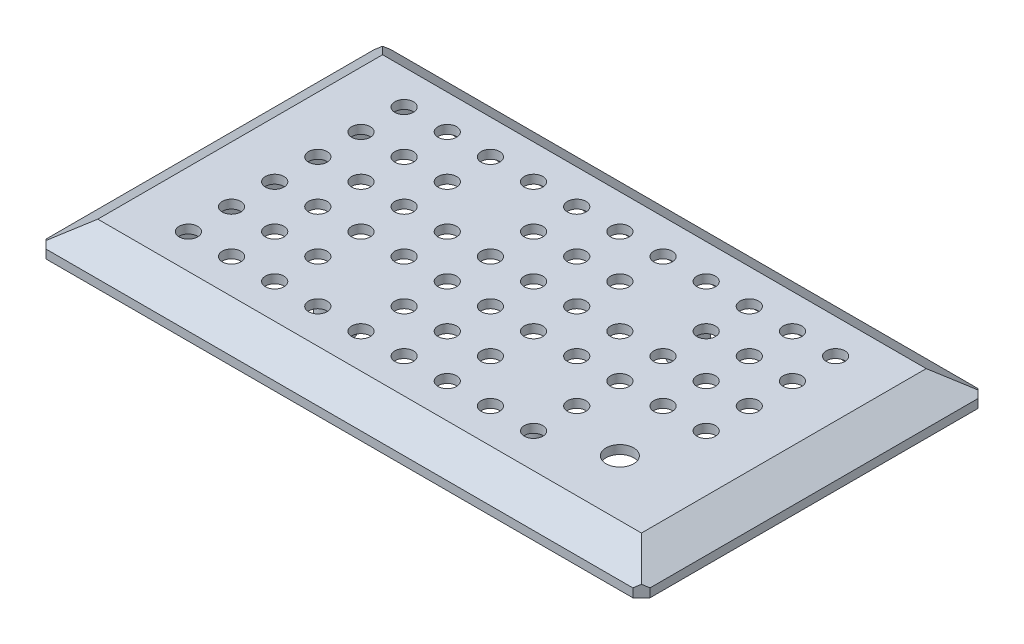
from build123d import *

# Parameters (mm, degrees)
SKETCH1_W                       = 140
SKETCH1_H                       = 80
BOSS_EXTRUDE1_DEPTH             = 2
CHAMFER2_SIZE                   = 2
SKETCH4_W                       = 8
SKETCH4_H                       = 10
BOSS_EXTRUDE2_DEPTH             = 7
SKETCH5_R                       = 2.05
CUT_EXTRUDE1_DEPTH              = 139.965499445
SKETCH6_W                       = 107.8
SKETCH6_H                       = 64
CUT_EXTRUDE2_DEPTH              = 5
SKIZZE1_R                       = 2.15
SCHNITT_LINEAR_AUSTRAGEN2_DEPTH = 10
SKIZZE2_W                       = 14.3
SKIZZE2_H                       = 14.3
SKIZZE2_R                       = 3.2
AUFSATZ_LINEAR_AUSTRAGEN1_DEPTH = 2
SKIZZE2_4_R                     = 3.2
SCHNITT_LINEAR_AUSTRAGEN4_DEPTH = 10
SKIZZE5_R                       = 2.15
AUFSATZ_LINEAR_AUSTRAGEN2_DEPTH = 2
SKIZZE4_R                       = 3.65
SKIZZE4_R_2                     = 2.05
AUFSATZ_LINEAR_AUSTRAGEN3_DEPTH = 10


with BuildPart() as part:
    # Sketch1 → Boss-Extrude1 (new body)
    with BuildSketch(Plane(origin=(0, 0, 0), x_dir=(1, 0, 0), z_dir=(0, 1, 0))):
        Rectangle(SKETCH1_W, SKETCH1_H)
    extrude(amount=BOSS_EXTRUDE1_DEPTH)

    # Sketch3 → Loft1 section 0
    with BuildSketch(Plane(origin=(0, 7, 0), x_dir=(1, 0, 0), z_dir=(0, 1, 0))):
        with BuildLine():
            Line((-63, -33), (63, -33))
            Line((63, -33), (63, 33))
            Line((63, 33), (-63, 33))
            Line((-63, 33), (-63, -33))
        make_face()
    # Sketch2 → Loft1 section 1
    with BuildSketch(Plane(origin=(0, 2, 0), x_dir=(1, 0, 0), z_dir=(0, 1, 0))):
        with BuildLine():
            Line((70, -40), (70, 40))
            Line((70, 40), (-70, 40))
            Line((-70, 40), (-70, -40))
            Line((-70, -40), (70, -40))
        make_face()
    loft()

    # Chamfer2
    chamfer2_edges = [part.edges().sort_by_distance(p)[0] for p in [
        (70, 1, 40),
        (-70, 1, 40),
        (-70, 1, -40),
        (70, 1, -40),
    ]]
    chamfer(chamfer2_edges, length=CHAMFER2_SIZE)

    # Sketch4 → Boss-Extrude2 (add)
    with BuildSketch(Plane.XZ):
        with Locations((-58.9, 20)):
            Rectangle(SKETCH4_W, SKETCH4_H)
        with Locations((-58.9, -20)):
            Rectangle(SKETCH4_W, SKETCH4_H)
        with Locations((58.9, -20)):
            Rectangle(SKETCH4_W, SKETCH4_H)
        with Locations((58.9, 20)):
            Rectangle(SKETCH4_W, SKETCH4_H)
    extrude(amount=BOSS_EXTRUDE2_DEPTH)

    # Sketch5 → Cut-Extrude1 (cut, through all)
    with BuildSketch(Plane.ZY.offset(62.9)):
        with Locations((-20, -3.5)):
            Circle(SKETCH5_R)
        with Locations((20, -3.5)):
            Circle(SKETCH5_R)
    extrude(amount=-CUT_EXTRUDE1_DEPTH, mode=Mode.SUBTRACT)

    # Sketch6 → Cut-Extrude2 (cut)
    with BuildSketch(Plane.XZ):
        Rectangle(SKETCH6_W, SKETCH6_H)
    extrude(amount=-CUT_EXTRUDE2_DEPTH, mode=Mode.SUBTRACT)

    # Skizze1 → Schnitt-Linear austragen2 (cut)
    with BuildSketch(Plane(origin=(0, 7, 0), x_dir=(1, 0, 0), z_dir=(0, 1, 0))):
        with Locations(Location((-50, -25, 0), (0, 0, 270))):
            Circle(SKIZZE1_R)
        with Locations(Location((-40, -25, 0), (0, 0, 270))):
            Circle(SKIZZE1_R)
        with Locations(Location((-30, -25, 0), (0, 0, 270))):
            Circle(SKIZZE1_R)
        with Locations(Location((-20, -25, 0), (0, 0, 270))):
            Circle(SKIZZE1_R)
        with Locations(Location((-10, -25, 0), (0, 0, 270))):
            Circle(SKIZZE1_R)
        with Locations(Location((0, -25, 0), (0, 0, 270))):
            Circle(SKIZZE1_R)
        with Locations(Location((10, -25, 0), (0, 0, 270))):
            Circle(SKIZZE1_R)
        with Locations(Location((20, -25, 0), (0, 0, 270))):
            Circle(SKIZZE1_R)
        with Locations(Location((30, -25, 0), (0, 0, 270))):
            Circle(SKIZZE1_R)
        with Locations(Location((40, -25, 0), (0, 0, 270))):
            Circle(SKIZZE1_R)
        with Locations(Location((50, -25, 0), (0, 0, 270))):
            Circle(SKIZZE1_R)
        with Locations(Location((-40, -15, 0), (0, 0, 270))):
            Circle(SKIZZE1_R)
        with Locations(Location((-30, -15, 0), (0, 0, 270))):
            Circle(SKIZZE1_R)
        with Locations(Location((-20, -15, 0), (0, 0, 270))):
            Circle(SKIZZE1_R)
        with Locations(Location((-10, -15, 0), (0, 0, 270))):
            Circle(SKIZZE1_R)
        with Locations(Location((0, -15, 0), (0, 0, 270))):
            Circle(SKIZZE1_R)
        with Locations(Location((10, -15, 0), (0, 0, 270))):
            Circle(SKIZZE1_R)
        with Locations(Location((20, -15, 0), (0, 0, 270))):
            Circle(SKIZZE1_R)
        with Locations(Location((30, -15, 0), (0, 0, 270))):
            Circle(SKIZZE1_R)
        with Locations(Location((40, -15, 0), (0, 0, 270))):
            Circle(SKIZZE1_R)
        with Locations(Location((50, -15, 0), (0, 0, 270))):
            Circle(SKIZZE1_R)
        with Locations(Location((-40, -5, 0), (0, 0, 270))):
            Circle(SKIZZE1_R)
        with Locations(Location((-30, -5, 0), (0, 0, 270))):
            Circle(SKIZZE1_R)
        with Locations(Location((-20, -5, 0), (0, 0, 270))):
            Circle(SKIZZE1_R)
        with Locations(Location((-10, -5, 0), (0, 0, 270))):
            Circle(SKIZZE1_R)
        with Locations(Location((0, -5, 0), (0, 0, 270))):
            Circle(SKIZZE1_R)
        with Locations(Location((10, -5, 0), (0, 0, 270))):
            Circle(SKIZZE1_R)
        with Locations(Location((20, -5, 0), (0, 0, 270))):
            Circle(SKIZZE1_R)
        with Locations(Location((30, -5, 0), (0, 0, 270))):
            Circle(SKIZZE1_R)
        with Locations(Location((40, -5, 0), (0, 0, 270))):
            Circle(SKIZZE1_R)
        with Locations(Location((50, -5, 0), (0, 0, 270))):
            Circle(SKIZZE1_R)
        with Locations(Location((-40, 5, 0), (0, 0, 270))):
            Circle(SKIZZE1_R)
        with Locations(Location((-30, 5, 0), (0, 0, 270))):
            Circle(SKIZZE1_R)
        with Locations(Location((-20, 5, 0), (0, 0, 270))):
            Circle(SKIZZE1_R)
        with Locations(Location((-10, 5, 0), (0, 0, 270))):
            Circle(SKIZZE1_R)
        with Locations(Location((0, 5, 0), (0, 0, 270))):
            Circle(SKIZZE1_R)
        with Locations(Location((10, 5, 0), (0, 0, 270))):
            Circle(SKIZZE1_R)
        with Locations(Location((20, 5, 0), (0, 0, 270))):
            Circle(SKIZZE1_R)
        with Locations(Location((30, 5, 0), (0, 0, 270))):
            Circle(SKIZZE1_R)
        with Locations(Location((40, 5, 0), (0, 0, 270))):
            Circle(SKIZZE1_R)
        with Locations(Location((50, 5, 0), (0, 0, 270))):
            Circle(SKIZZE1_R)
        with Locations(Location((-40, 15, 0), (0, 0, 270))):
            Circle(SKIZZE1_R)
        with Locations(Location((-30, 15, 0), (0, 0, 270))):
            Circle(SKIZZE1_R)
        with Locations(Location((-20, 15, 0), (0, 0, 270))):
            Circle(SKIZZE1_R)
        with Locations(Location((-10, 15, 0), (0, 0, 270))):
            Circle(SKIZZE1_R)
        with Locations(Location((0, 15, 0), (0, 0, 270))):
            Circle(SKIZZE1_R)
        with Locations(Location((10, 15, 0), (0, 0, 270))):
            Circle(SKIZZE1_R)
        with Locations(Location((20, 15, 0), (0, 0, 270))):
            Circle(SKIZZE1_R)
        with Locations(Location((30, 15, 0), (0, 0, 270))):
            Circle(SKIZZE1_R)
        with Locations(Location((40, 15, 0), (0, 0, 270))):
            Circle(SKIZZE1_R)
        with Locations(Location((50, 15, 0), (0, 0, 270))):
            Circle(SKIZZE1_R)
        with Locations(Location((-40, 25, 0), (0, 0, 270))):
            Circle(SKIZZE1_R)
        with Locations(Location((-30, 25, 0), (0, 0, 270))):
            Circle(SKIZZE1_R)
        with Locations(Location((-20, 25, 0), (0, 0, 270))):
            Circle(SKIZZE1_R)
        with Locations(Location((-10, 25, 0), (0, 0, 270))):
            Circle(SKIZZE1_R)
        with Locations(Location((0, 25, 0), (0, 0, 270))):
            Circle(SKIZZE1_R)
        with Locations(Location((10, 25, 0), (0, 0, 270))):
            Circle(SKIZZE1_R)
        with Locations(Location((20, 25, 0), (0, 0, 270))):
            Circle(SKIZZE1_R)
        with Locations(Location((30, 25, 0), (0, 0, 270))):
            Circle(SKIZZE1_R)
        with Locations(Location((40, 25, 0), (0, 0, 270))):
            Circle(SKIZZE1_R)
        with Locations(Location((50, 25, 0), (0, 0, 270))):
            Circle(SKIZZE1_R)
        with Locations(Location((-50, -15, 0), (0, 0, 270))):
            Circle(SKIZZE1_R)
        with Locations(Location((-50, -5, 0), (0, 0, 270))):
            Circle(SKIZZE1_R)
        with Locations(Location((-50, 5, 0), (0, 0, 270))):
            Circle(SKIZZE1_R)
        with Locations(Location((-50, 15, 0), (0, 0, 270))):
            Circle(SKIZZE1_R)
        with Locations(Location((-50, 25, 0), (0, 0, 270))):
            Circle(SKIZZE1_R)
    extrude(amount=-SCHNITT_LINEAR_AUSTRAGEN2_DEPTH, mode=Mode.SUBTRACT)

    # Skizze2 → Aufsatz-Linear austragen1 (add)
    with BuildSketch(Plane(origin=(0, 7, 0), x_dir=(1, 0, 0), z_dir=(0, 1, 0))):
        with Locations((45, -20)):
            Rectangle(SKIZZE2_W, SKIZZE2_H)
        with Locations((45, -20)):
            Circle(SKIZZE2_R, mode=Mode.SUBTRACT)
    extrude(amount=-AUFSATZ_LINEAR_AUSTRAGEN1_DEPTH)

    # Skizze2<4> → Schnitt-Linear austragen4 (cut)
    with BuildSketch(Plane(origin=(0, 7, 0), x_dir=(1, 0, 0), z_dir=(0, 1, 0))):
        with Locations(Location((45, -20, 0), (0, 0, 270))):
            Circle(SKIZZE2_4_R)
    extrude(amount=-SCHNITT_LINEAR_AUSTRAGEN4_DEPTH, mode=Mode.SUBTRACT)

    # Skizze5 → Aufsatz-Linear austragen2 (add)
    with BuildSketch(Plane(origin=(0, 7, 0), x_dir=(1, 0, 0), z_dir=(0, 1, 0))):
        with Locations((20, -15)):
            Circle(SKIZZE5_R)
        with Locations((20, 15)):
            Circle(SKIZZE5_R)
        with Locations((-20, 15)):
            Circle(SKIZZE5_R)
        with Locations((-20, -15)):
            Circle(SKIZZE5_R)
    extrude(amount=-AUFSATZ_LINEAR_AUSTRAGEN2_DEPTH)

    # Skizze4 → Aufsatz-Linear austragen3 (add)
    # profile 1 of 4: a face of its own
    with BuildSketch(Plane(origin=(0, 7, 0), x_dir=(1, 0, 0), z_dir=(0, 1, 0))):
        with Locations(Location((-23.105, 17.725, 0), (0, 0, 270))):
            Circle(SKIZZE4_R)
        with Locations(Location((-23.105, 17.725, 0), (0, 0, 270))):
            Circle(SKIZZE4_R_2, mode=Mode.SUBTRACT)
    # profile 2 of 4: a face of its own
    with BuildSketch(Plane(origin=(0, 7, 0), x_dir=(1, 0, 0), z_dir=(0, 1, 0))):
        with Locations(Location((23.105, 17.725, 0), (0, 0, 270))):
            Circle(SKIZZE4_R)
        with Locations(Location((23.105, 17.725, 0), (0, 0, 270))):
            Circle(SKIZZE4_R_2, mode=Mode.SUBTRACT)
    # profile 3 of 4: a face of its own
    with BuildSketch(Plane(origin=(0, 7, 0), x_dir=(1, 0, 0), z_dir=(0, 1, 0))):
        with Locations(Location((23.105, -17.725, 0), (0, 0, 270))):
            Circle(SKIZZE4_R)
        with Locations(Location((23.105, -17.725, 0), (0, 0, 270))):
            Circle(SKIZZE4_R_2, mode=Mode.SUBTRACT)
    # profile 4 of 4: a face of its own
    with BuildSketch(Plane(origin=(0, 7, 0), x_dir=(1, 0, 0), z_dir=(0, 1, 0))):
        with Locations(Location((-23.105, -17.725, 0), (0, 0, 270))):
            Circle(SKIZZE4_R)
        with Locations(Location((-23.105, -17.725, 0), (0, 0, 270))):
            Circle(SKIZZE4_R_2, mode=Mode.SUBTRACT)
    extrude(amount=-AUFSATZ_LINEAR_AUSTRAGEN3_DEPTH)


solid = part.part
